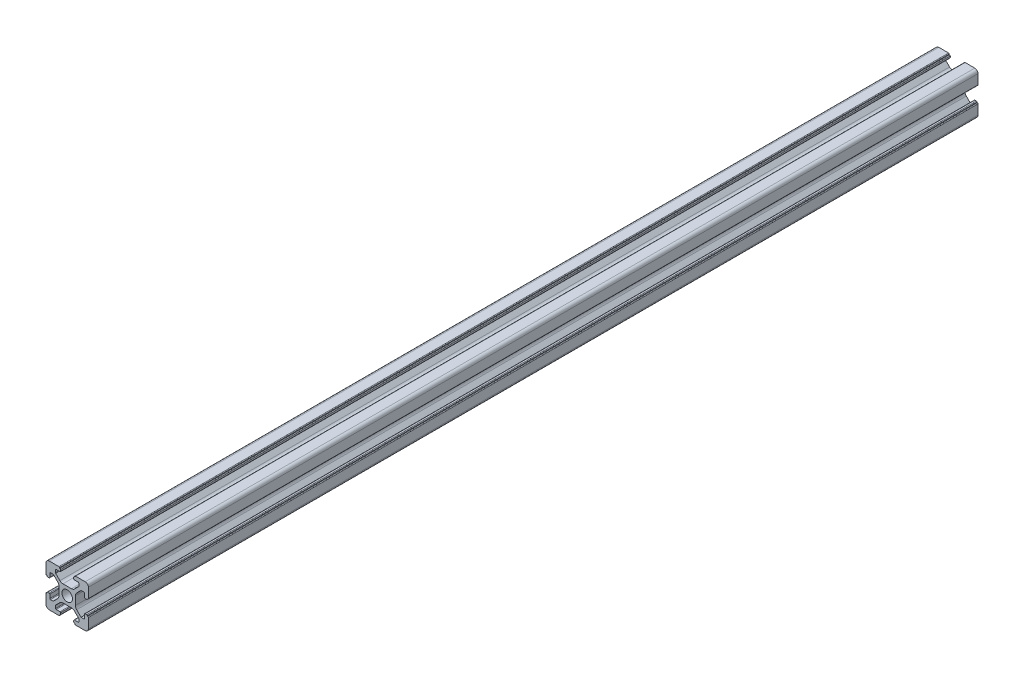
from build123d import *

# Parameters (mm, degrees)
SKETCH_191_R    = 2.5
EXTRUDE_1_DEPTH = 420


with BuildPart() as part:
    # Sketch 191 → 凸台-拉伸1 (new body)
    with BuildSketch(Plane.XY):
        with BuildLine():
            Line((3961.92734864, 92.136143898), (3963.914354409, 94.123149666))
            ThreePointArc((3963.914354409, 94.123149666), (3964.011681414, 94.188181491), (3964.126486443, 94.211017632))
            Line((3964.126486443, 94.211017632), (3965.341562203, 94.211017632))
            ThreePointArc((3965.341562203, 94.211017632), (3965.553694237, 94.123149666), (3965.641562203, 93.911017632))
            Line((3965.641562203, 93.911017632), (3965.641562203, 92.111017631))
            ThreePointArc((3965.641562203, 92.111017631), (3965.729430168, 91.898885597), (3965.941562203, 91.811017632))
            Line((3965.941562203, 91.811017632), (3966.641562203, 91.811017632))
            ThreePointArc((3966.641562203, 91.811017632), (3966.853694237, 91.898885597), (3966.941562203, 92.111017632))
            Line((3966.941562203, 92.111017632), (3966.941562203, 92.311017632))
            Line((3966.941562203, 92.311017632), (3967.141562203, 92.311017632))
            ThreePointArc((3967.141562203, 92.311017632), (3967.353694237, 92.398885597), (3967.441562203, 92.611017632))
            Line((3967.441562203, 92.611017632), (3967.441562203, 97.211017632))
            ThreePointArc((3967.441562203, 97.211017632), (3967.002222375, 98.271677803), (3965.941562203, 98.711017632))
            Line((3965.941562203, 98.711017632), (3961.341562203, 98.711017632))
            ThreePointArc((3961.341562203, 98.711017632), (3961.129430168, 98.623149666), (3961.041562203, 98.411017632))
            Line((3961.041562203, 98.411017632), (3961.041562203, 98.211017632))
            Line((3961.041562203, 98.211017632), (3960.841562203, 98.211017632))
            ThreePointArc((3960.841562203, 98.211017632), (3960.629430168, 98.123149666), (3960.541562203, 97.911017632))
            Line((3960.541562203, 97.911017632), (3960.541562203, 97.211017631))
            ThreePointArc((3960.541562203, 97.211017631), (3960.629430168, 96.998885597), (3960.841562203, 96.911017632))
            Line((3960.841562203, 96.911017632), (3962.641562203, 96.911017632))
            ThreePointArc((3962.641562203, 96.911017632), (3962.853694237, 96.823149666), (3962.941562203, 96.611017632))
            Line((3962.941562203, 96.611017632), (3962.941562203, 95.395941872))
            ThreePointArc((3962.941562203, 95.395941872), (3962.918726063, 95.281136842), (3962.853694237, 95.183809838))
            Line((3962.853694237, 95.183809838), (3960.866688469, 93.196804069))
            ThreePointArc((3960.866688469, 93.196804069), (3960.217841771, 92.763258567), (3959.452474906, 92.611017632))
            Line((3959.452474906, 92.611017632), (3955.430649499, 92.611017632))
            ThreePointArc((3955.430649499, 92.611017632), (3954.665282635, 92.763258567), (3954.016435937, 93.196804069))
            Line((3954.016435937, 93.196804069), (3952.029430168, 95.183809838))
            ThreePointArc((3952.029430168, 95.183809838), (3951.964398343, 95.281136842), (3951.941562203, 95.395941872))
            Line((3951.941562203, 95.395941872), (3951.941562203, 96.611017632))
            ThreePointArc((3951.941562203, 96.611017632), (3952.029430168, 96.823149666), (3952.241562203, 96.911017632))
            Line((3952.241562203, 96.911017632), (3954.041562203, 96.911017632))
            ThreePointArc((3954.041562203, 96.911017632), (3954.253694237, 96.998885597), (3954.341562203, 97.211017631))
            Line((3954.341562203, 97.211017631), (3954.341562203, 97.911017632))
            ThreePointArc((3954.341562203, 97.911017632), (3954.253694237, 98.123149666), (3954.041562203, 98.211017632))
            Line((3954.041562203, 98.211017632), (3953.841562203, 98.211017632))
            Line((3953.841562203, 98.211017632), (3953.841562203, 98.411017632))
            ThreePointArc((3953.841562203, 98.411017632), (3953.753694237, 98.623149666), (3953.541562203, 98.711017632))
            Line((3953.541562203, 98.711017632), (3948.941562203, 98.711017632))
            ThreePointArc((3948.941562203, 98.711017632), (3947.880902031, 98.271677803), (3947.441562203, 97.211017632))
            Line((3947.441562203, 97.211017632), (3947.441562203, 92.611017632))
            ThreePointArc((3947.441562203, 92.611017632), (3947.529430168, 92.398885597), (3947.741562203, 92.311017632))
            Line((3947.741562203, 92.311017632), (3947.941562203, 92.311017632))
            Line((3947.941562203, 92.311017632), (3947.941562203, 92.111017632))
            ThreePointArc((3947.941562203, 92.111017632), (3948.029430168, 91.898885597), (3948.241562203, 91.811017632))
            Line((3948.241562203, 91.811017632), (3948.941562203, 91.811017632))
            ThreePointArc((3948.941562203, 91.811017632), (3949.153694237, 91.898885597), (3949.241562203, 92.111017632))
            Line((3949.241562203, 92.111017632), (3949.241562203, 93.911017632))
            ThreePointArc((3949.241562203, 93.911017632), (3949.329430168, 94.123149666), (3949.541562203, 94.211017632))
            Line((3949.541562203, 94.211017632), (3950.756637962, 94.211017632))
            ThreePointArc((3950.756637962, 94.211017632), (3950.871442992, 94.188181491), (3950.968769997, 94.123149666))
            Line((3950.968769997, 94.123149666), (3952.955775765, 92.136143898))
            ThreePointArc((3952.955775765, 92.136143898), (3953.389321268, 91.4872972), (3953.541562203, 90.721930335))
            Line((3953.541562203, 90.721930335), (3953.541562203, 86.700104928))
            ThreePointArc((3953.541562203, 86.700104928), (3953.389321268, 85.934738063), (3952.955775765, 85.285891366))
            Line((3952.955775765, 85.285891366), (3950.968769997, 83.298885597))
            ThreePointArc((3950.968769997, 83.298885597), (3950.871442992, 83.233853772), (3950.756637962, 83.211017632))
            Line((3950.756637962, 83.211017632), (3949.541562203, 83.211017632))
            ThreePointArc((3949.541562203, 83.211017632), (3949.329430168, 83.298885597), (3949.241562203, 83.511017632))
            Line((3949.241562203, 83.511017632), (3949.241562203, 85.311017632))
            ThreePointArc((3949.241562203, 85.311017632), (3949.153694237, 85.523149666), (3948.941562203, 85.611017632))
            Line((3948.941562203, 85.611017632), (3948.241562203, 85.611017632))
            ThreePointArc((3948.241562203, 85.611017632), (3948.029430168, 85.523149666), (3947.941562203, 85.311017632))
            Line((3947.941562203, 85.311017632), (3947.941562203, 85.111017632))
            Line((3947.941562203, 85.111017632), (3947.741562203, 85.111017632))
            ThreePointArc((3947.741562203, 85.111017632), (3947.529430168, 85.023149666), (3947.441562203, 84.811017632))
            Line((3947.441562203, 84.811017632), (3947.441562203, 80.211017632))
            ThreePointArc((3947.441562203, 80.211017632), (3947.880902031, 79.15035746), (3948.941562203, 78.711017632))
            Line((3948.941562203, 78.711017632), (3953.541562203, 78.711017632))
            ThreePointArc((3953.541562203, 78.711017632), (3953.753694237, 78.798885597), (3953.841562203, 79.011017632))
            ThreePointArc((3953.841562203, 79.011017632), (3953.900140847, 79.152438988), (3954.041562203, 79.211017632))
            ThreePointArc((3954.041562203, 79.211017632), (3954.253694237, 79.298885597), (3954.341562203, 79.511017632))
            Line((3954.341562203, 79.511017632), (3954.341562203, 80.211017632))
            ThreePointArc((3954.341562203, 80.211017632), (3954.253694237, 80.423149666), (3954.041562203, 80.511017632))
            Line((3954.041562203, 80.511017632), (3952.241562203, 80.511017632))
            ThreePointArc((3952.241562203, 80.511017632), (3952.029430168, 80.598885597), (3951.941562203, 80.811017632))
            Line((3951.941562203, 80.811017632), (3951.941562203, 82.026093391))
            ThreePointArc((3951.941562203, 82.026093391), (3951.964398343, 82.140898421), (3952.029430168, 82.238225425))
            Line((3952.029430168, 82.238225425), (3954.016435937, 84.225231194))
            ThreePointArc((3954.016435937, 84.225231194), (3954.665282635, 84.658776697), (3955.4306495, 84.811017632))
            Line((3955.4306495, 84.811017632), (3959.452474906, 84.811017632))
            ThreePointArc((3959.452474906, 84.811017632), (3960.217841771, 84.658776697), (3960.866688469, 84.225231194))
            Line((3960.866688469, 84.225231194), (3962.853694237, 82.238225425))
            ThreePointArc((3962.853694237, 82.238225425), (3962.918726063, 82.140898421), (3962.941562203, 82.026093391))
            Line((3962.941562203, 82.026093391), (3962.941562203, 80.811017632))
            ThreePointArc((3962.941562203, 80.811017632), (3962.853694237, 80.598885597), (3962.641562203, 80.511017632))
            Line((3962.641562203, 80.511017632), (3960.841562203, 80.511017632))
            ThreePointArc((3960.841562203, 80.511017632), (3960.629430168, 80.423149666), (3960.541562203, 80.211017632))
            Line((3960.541562203, 80.211017632), (3960.541562203, 79.511017632))
            ThreePointArc((3960.541562203, 79.511017632), (3960.629430168, 79.298885597), (3960.841562203, 79.211017632))
            ThreePointArc((3960.841562203, 79.211017632), (3960.982983559, 79.152438988), (3961.041562203, 79.011017632))
            ThreePointArc((3961.041562203, 79.011017632), (3961.129430168, 78.798885597), (3961.341562203, 78.711017632))
            Line((3961.341562203, 78.711017632), (3965.941562203, 78.711017632))
            ThreePointArc((3965.941562203, 78.711017632), (3967.002222375, 79.15035746), (3967.441562203, 80.211017632))
            Line((3967.441562203, 80.211017632), (3967.441562203, 84.811017632))
            ThreePointArc((3967.441562203, 84.811017632), (3967.353694237, 85.023149666), (3967.141562203, 85.111017632))
            Line((3967.141562203, 85.111017632), (3966.941562203, 85.111017632))
            Line((3966.941562203, 85.111017632), (3966.941562203, 85.311017632))
            ThreePointArc((3966.941562203, 85.311017632), (3966.853694237, 85.523149666), (3966.641562203, 85.611017632))
            Line((3966.641562203, 85.611017632), (3965.941562203, 85.611017632))
            ThreePointArc((3965.941562203, 85.611017632), (3965.729430168, 85.523149666), (3965.641562203, 85.311017632))
            Line((3965.641562203, 85.311017632), (3965.641562203, 83.511017632))
            ThreePointArc((3965.641562203, 83.511017632), (3965.553694237, 83.298885597), (3965.341562203, 83.211017632))
            Line((3965.341562203, 83.211017632), (3964.002222375, 83.211017632))
            Line((3964.002222375, 83.211017632), (3961.92734864, 85.285891366))
            ThreePointArc((3961.92734864, 85.285891366), (3961.493803138, 85.934738063), (3961.341562203, 86.700104928))
            Line((3961.341562203, 86.700104928), (3961.341562203, 90.721930335))
            ThreePointArc((3961.341562203, 90.721930335), (3961.493803138, 91.4872972), (3961.92734864, 92.136143898))
        make_face()
        with Locations((3957.441562203, 88.711017632)):
            Circle(SKETCH_191_R, mode=Mode.SUBTRACT)
    extrude(amount=EXTRUDE_1_DEPTH)


solid = part.part
